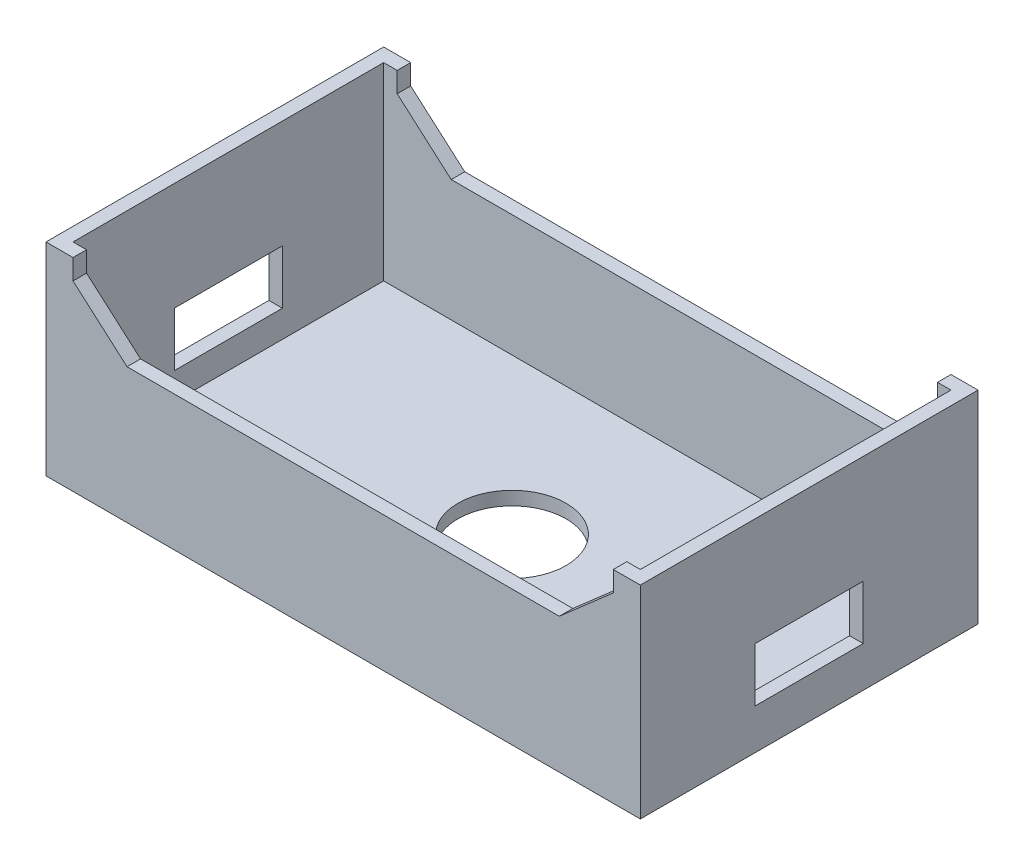
from build123d import *

# Parameters (mm, degrees)
CROQUIS1_W              = 44
CROQUIS1_H              = 25
SALIENTE_EXTRUIR2_DEPTH = 10
CROQUIS2_W              = 42
CROQUIS2_H              = 23
CORTAR_EXTRUIR1_DEPTH   = 9
SALIENTE_EXTRUIR3_DEPTH = 25
CROQUIS4_W              = 42
CROQUIS4_H              = 23
CORTAR_EXTRUIR2_DEPTH   = 28
CROQUIS5_W              = 1
CROQUIS5_H              = 23
CORTAR_EXTRUIR10_DEPTH  = 5
CROQUIS6_W              = 29.89343235
CROQUIS6_H              = 11.447342814
CORTAR_EXTRUIR11_DEPTH  = 1
CROQUIS7_W              = 31.003837105
CROQUIS7_H              = 9.868746677
CORTAR_EXTRUIR12_DEPTH  = 1
CROQUIS8_W              = 1
CROQUIS8_H              = 23
SALIENTE_EXTRUIR4_DEPTH = 5
CROQUIS9_W              = 8
CROQUIS9_H              = 4
CORTAR_EXTRUIR17_DEPTH  = 87
CROQUIS10_R             = 4
CORTAR_EXTRUIR19_DEPTH  = 10


with BuildPart() as part:
    # Croquis1 → Saliente-Extruir2 (new body)
    with BuildSketch(Plane(origin=(0, 0, 0), x_dir=(1, 0, 0), z_dir=(0, 1, 0))):
        Rectangle(CROQUIS1_W, CROQUIS1_H)
    extrude(amount=SALIENTE_EXTRUIR2_DEPTH)

    # Croquis2 → Cortar-Extruir1 (cut)
    with BuildSketch(Plane(origin=(0, 10, 0), x_dir=(1, 0, 0), z_dir=(0, 1, 0))):
        Rectangle(CROQUIS2_W, CROQUIS2_H)
    extrude(amount=-CORTAR_EXTRUIR1_DEPTH, mode=Mode.SUBTRACT)

    # Croquis3 → Saliente-Extruir3 (add)
    with BuildSketch(Plane.XY.offset(12.5)):
        Polygon((-22, 8), (-22, 10), (-16, 10), (-20, 13.5), (-20, 15), (-23, 15), (-23, 8), align=None)
        Polygon((20, 13.5), (16, 10), (22, 10), (22, 8), (23, 8), (23, 15), (20, 15), align=None)
    extrude(amount=-SALIENTE_EXTRUIR3_DEPTH)

    # Croquis4 → Cortar-Extruir2 (cut)
    with BuildSketch(Plane(origin=(0, 1, 0), x_dir=(1, 0, 0), z_dir=(0, 1, 0))):
        Rectangle(CROQUIS4_W, CROQUIS4_H)
    extrude(amount=CORTAR_EXTRUIR2_DEPTH, mode=Mode.SUBTRACT)

    # Croquis5 → Cortar-Extruir10 (cut)
    with BuildSketch(Plane(origin=(0, 15, 0), x_dir=(1, 0, 0), z_dir=(0, 1, 0))):
        with Locations((-21.5, 0)):
            Rectangle(CROQUIS5_W, CROQUIS5_H)
        with Locations((21.5, 0)):
            Rectangle(CROQUIS5_W, CROQUIS5_H)
    extrude(amount=-CORTAR_EXTRUIR10_DEPTH, mode=Mode.SUBTRACT)

    # Croquis6 → Cortar-Extruir11 (cut)
    with BuildSketch(Plane(origin=(23, 0, 0), x_dir=(0, 0, -1), z_dir=(1, 0, 0))):
        with Locations((-0.524699003, 11.114026003)):
            Rectangle(CROQUIS6_W, CROQUIS6_H)
    extrude(amount=-CORTAR_EXTRUIR11_DEPTH, mode=Mode.SUBTRACT)

    # Croquis7 → Cortar-Extruir12 (cut)
    with BuildSketch(Plane.ZY.offset(23)):
        with Locations((-0.729719636, 12.255463236)):
            Rectangle(CROQUIS7_W, CROQUIS7_H)
    extrude(amount=-CORTAR_EXTRUIR12_DEPTH, mode=Mode.SUBTRACT)

    # Croquis8 → Saliente-Extruir4 (add)
    with BuildSketch(Plane(origin=(0, 10, 0), x_dir=(1, 0, 0), z_dir=(0, 1, 0))):
        with Locations((-21.5, 0)):
            Rectangle(CROQUIS8_W, CROQUIS8_H)
        with Locations((21.5, 0)):
            Rectangle(CROQUIS8_W, CROQUIS8_H)
    extrude(amount=SALIENTE_EXTRUIR4_DEPTH)

    # Croquis9 → Cortar-Extruir17 (cut)
    with BuildSketch(Plane.ZY.offset(22)):
        with Locations((0, 5)):
            Rectangle(CROQUIS9_W, CROQUIS9_H)
    extrude(amount=-CORTAR_EXTRUIR17_DEPTH, mode=Mode.SUBTRACT)

    # Croquis10 → Cortar-Extruir19 (cut)
    with BuildSketch(Plane.XZ):
        Circle(CROQUIS10_R)
    extrude(amount=-CORTAR_EXTRUIR19_DEPTH, mode=Mode.SUBTRACT)


solid = part.part
